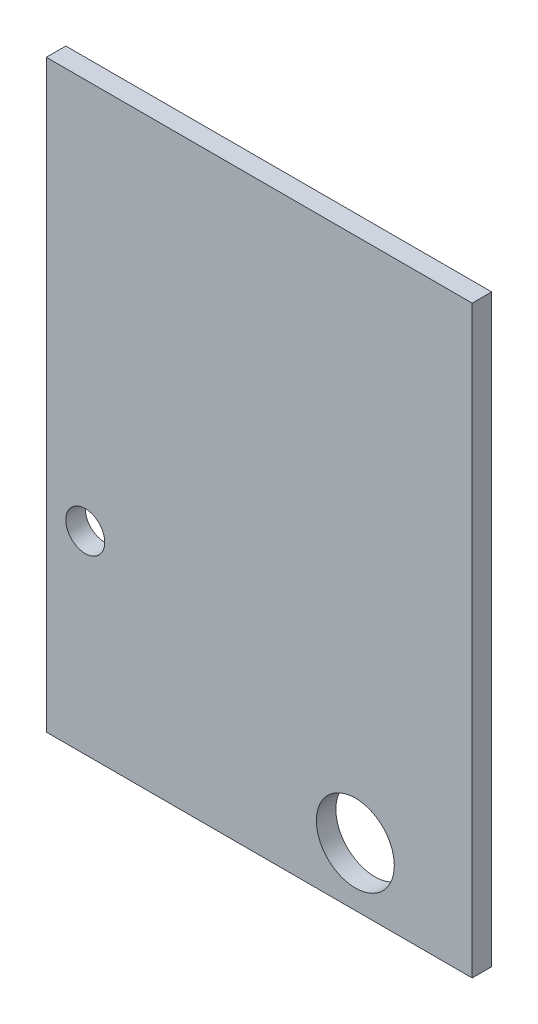
from build123d import *

# Parameters (mm, degrees)
SKETCH1_W           = 218.63
SKETCH1_H           = 300
SKETCH1_R           = 20
SKETCH1_R_2         = 10
BOSS_EXTRUDE1_DEPTH = 10


with BuildPart() as part:
    # Sketch1 → Boss-Extrude1 (new body)
    with BuildSketch(Plane.XY):
        with Locations((-49.315, 120)):
            Rectangle(SKETCH1_W, SKETCH1_H)
        Circle(SKETCH1_R, mode=Mode.SUBTRACT)
        with Locations((-138.63, 69.36)):
            Circle(SKETCH1_R_2, mode=Mode.SUBTRACT)
    extrude(amount=BOSS_EXTRUDE1_DEPTH)


solid = part.part
